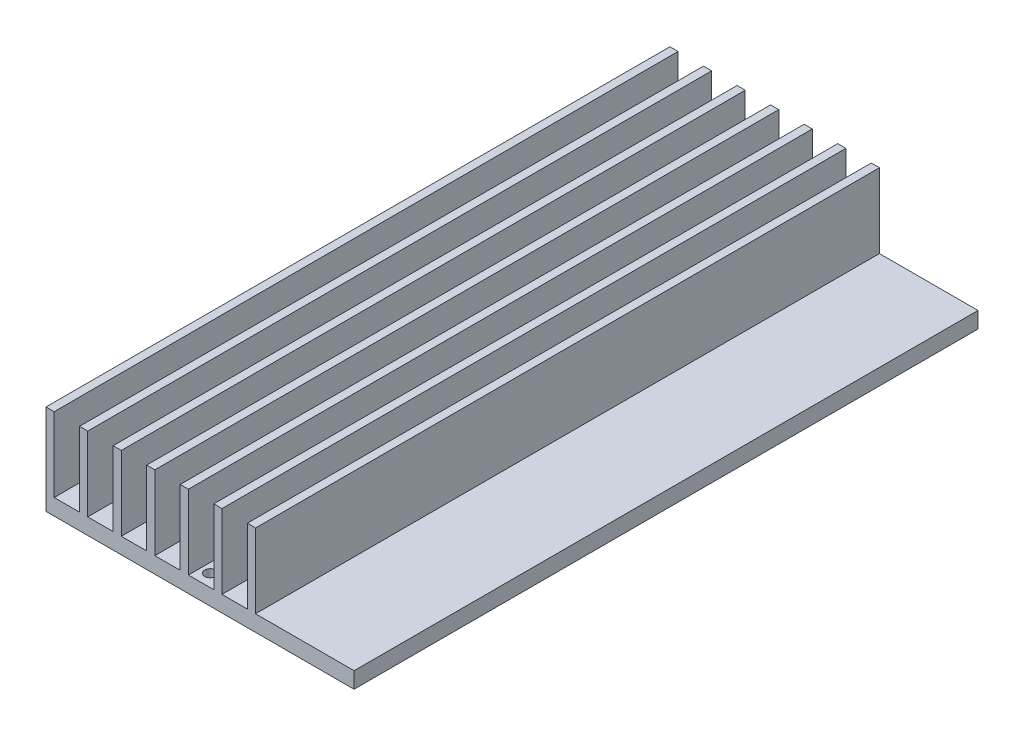
from build123d import *

# Parameters (mm, degrees)
BOSS_EXTRUDE1_DEPTH = 184.15
SKETCH2_R           = 1.651
SKETCH2_R_2         = 2.0701
SKETCH2_R_3         = 2.0955
CUT_EXTRUDE3_DEPTH  = 10


with BuildPart() as part:
    # Sketch1 → Boss-Extrude1 (new body)
    with BuildSketch(Plane.XY):
        Polygon((2.413, 26.6954), (0, 26.6954), (0, 4.7498), (0, 0), (61.849, 0), (69.342, 0), (90.932, 0), (90.932, 4.7498), (69.342, 4.7498), (61.849, 4.7498), (61.849, 26.6954), (59.436, 26.6954), (59.436, 4.7498), (51.943, 4.7498), (51.943, 26.6954), (49.53, 26.6954), (49.53, 4.7498), (42.037, 4.7498), (42.037, 26.6954), (39.624, 26.6954), (39.624, 4.7498), (32.131, 4.7498), (32.131, 26.6954), (29.718, 26.6954), (29.718, 4.7498), (22.225, 4.7498), (22.225, 26.6954), (19.812, 26.6954), (19.812, 4.7498), (12.319, 4.7498), (12.319, 26.6954), (9.906, 26.6954), (9.906, 4.7498), (2.413, 4.7498), align=None)
    extrude(amount=BOSS_EXTRUDE1_DEPTH)

    # Sketch2 → Cut-Extrude3 (cut)
    with BuildSketch(Plane.XZ):
        with Locations((5.2324, 159.131)):
            Circle(SKETCH2_R)
        with Locations((44.8056, 180.467)):
            Circle(SKETCH2_R)
        with Locations((44.8056, 143.243)):
            Circle(SKETCH2_R)
        with Locations((5.2324, 121.907)):
            Circle(SKETCH2_R)
        with Locations((5.2324, 84.683)):
            Circle(SKETCH2_R)
        with Locations((44.8056, 106.019)):
            Circle(SKETCH2_R)
        with Locations((17.0185, 72.3)):
            Circle(SKETCH2_R_2)
        with Locations((25.0185, 72.3)):
            Circle(SKETCH2_R_2)
        with Locations((25.0185, 5.7)):
            Circle(SKETCH2_R_2)
        with Locations((17.0185, 5.7)):
            Circle(SKETCH2_R_2)
        with Locations((38.317522863, 39)):
            Circle(SKETCH2_R_3)
    extrude(amount=-CUT_EXTRUDE3_DEPTH, mode=Mode.SUBTRACT)


solid = part.part
